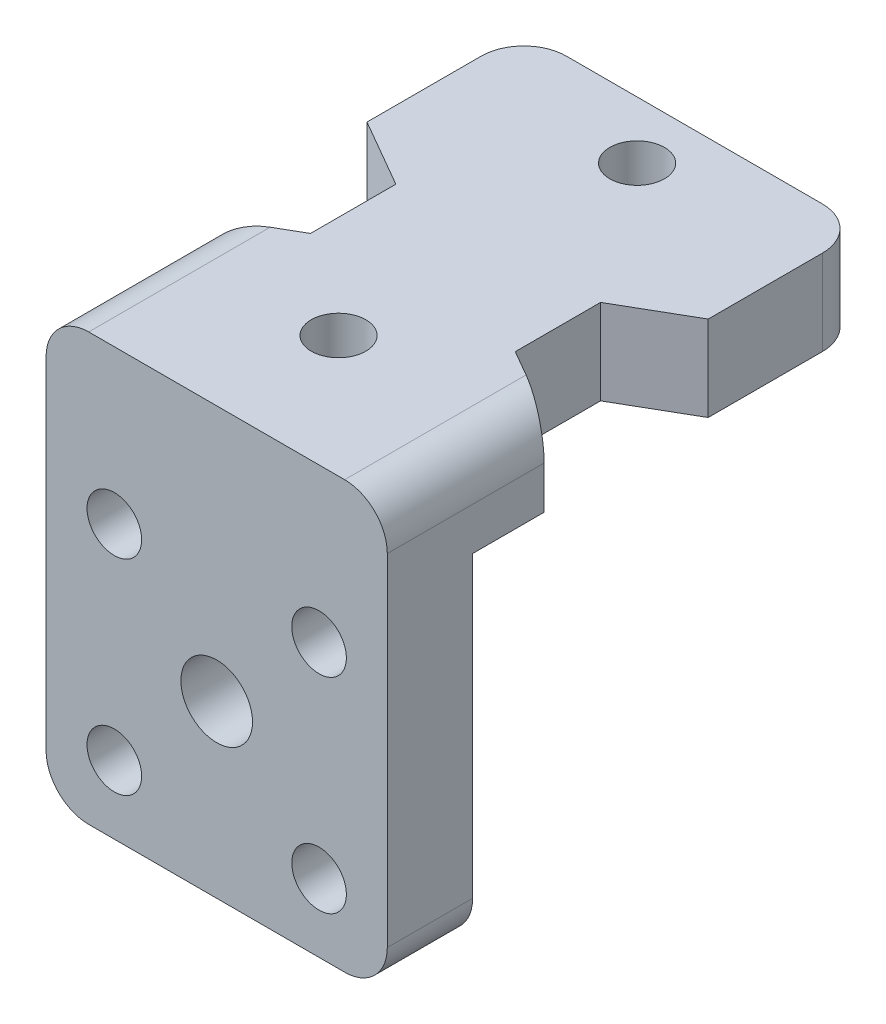
from build123d import *

# Parameters (mm, degrees)
SKETCH2_W           = 20
SKETCH2_H           = 20
BOSS_EXTRUDE1_DEPTH = 5
SKETCH3_R           = 2.1
CUT_EXTRUDE1_DEPTH  = 5
FILLET2_R           = 2.5
SKETCH5_R           = 1.6
BOSS_EXTRUDE2_DEPTH = 5
FILLET4_R           = 2.5
SKETCH6_R           = 1.6
CUT_EXTRUDE2_DEPTH  = 10


with BuildPart() as part:
    # Sketch2 → Boss-Extrude1 (new body)
    with BuildSketch(Plane.XY):
        Rectangle(SKETCH2_W, SKETCH2_H)
    extrude(amount=BOSS_EXTRUDE1_DEPTH)

    # Sketch3 → Cut-Extrude1 (cut)
    with BuildSketch(Plane.XY.offset(5)):
        Circle(SKETCH3_R)
    extrude(amount=-CUT_EXTRUDE1_DEPTH, mode=Mode.SUBTRACT)

    # Fillet2
    fillet2_edges = [part.edges().sort_by_distance(p)[0] for p in [
        (10, -10, 2.5),
        (-10, -10, 2.5),
    ]]
    fillet(fillet2_edges, radius=FILLET2_R)

    # Sketch5 → Boss-Extrude2 (add)
    with BuildSketch(Plane(origin=(0, 10, 0), x_dir=(1, 0, 0), z_dir=(0, 1, 0))):
        Polygon((-10, -5), (10, -5), (10, 4.190598923), (6, 6.5), (6, 11.5), (10, 13.809401077), (10, 23), (-10, 23), (-10, 13.809401077), (-6, 11.5), (-6, 6.5), (-10, 4.190598923), align=None)
        with Locations(Location((0, 2.141483503, 0), (0, 0, 270))):
            Circle(SKETCH5_R, mode=Mode.SUBTRACT)
        with Locations(Location((0, 19.641483503, 0), (0, 0, 270))):
            Circle(SKETCH5_R, mode=Mode.SUBTRACT)
    extrude(amount=BOSS_EXTRUDE2_DEPTH)

    # Fillet4
    fillet4_edges = [part.edges().sort_by_distance(p)[0] for p in [
        (-10, 15, 0.404700538),
        (10, 15, 0.404700538),
        (10, 12.5, -23),
        (-10, 12.5, -23),
    ]]
    fillet(fillet4_edges, radius=FILLET4_R)

    # Sketch6 → Cut-Extrude2 (cut)
    with BuildSketch(Plane(origin=(0, 0, 0), x_dir=(-1, 0, 0), z_dir=(0, 0, -1))):
        with Locations((-6, 6)):
            Circle(SKETCH6_R)
        with Locations((6, 6)):
            Circle(SKETCH6_R)
        with Locations((6, -6)):
            Circle(SKETCH6_R)
        with Locations((-6, -6)):
            Circle(SKETCH6_R)
    extrude(amount=-CUT_EXTRUDE2_DEPTH, mode=Mode.SUBTRACT)


solid = part.part
